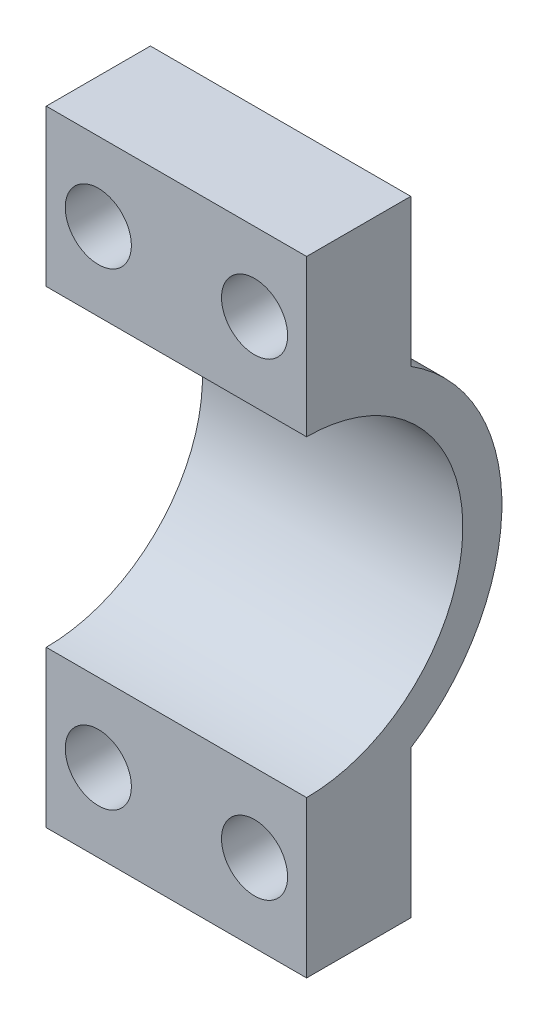
from build123d import *

# Parameters (mm, degrees)
BOSS_EXTRUDE1_DEPTH        = 25
F_1_2_0_5_DIAMETER_HOLE1_D = 12.7


with BuildPart() as part:
    # Sketch1 → Boss-Extrude1 (new, symmetric)
    with BuildSketch(Plane(origin=(0, 0, 0), x_dir=(0, 0, -1), z_dir=(1, 0, 0))):
        with BuildLine():
            Line((0, -30), (0, -60))
            Line((0, -60), (20, -60))
            Line((20, -60), (20, -31.721443851))
            ThreePointArc((20, -31.721443851), (37.5, 0), (20, 31.721443851))
            Line((20, 31.721443851), (20, 60))
            Line((20, 60), (0, 60))
            Line((0, 60), (0, 30))
            ThreePointArc((0, 30), (30, 0), (0, -30))
        make_face()
    extrude(amount=BOSS_EXTRUDE1_DEPTH, both=True)

    # 1/2 (0.5) Diameter Hole1 (through all)
    with Locations(Plane.XY):
        with Locations((-15, 45), (15, 45), (15, -45), (-15, -45)):
            Hole(F_1_2_0_5_DIAMETER_HOLE1_D / 2)


solid = part.part
